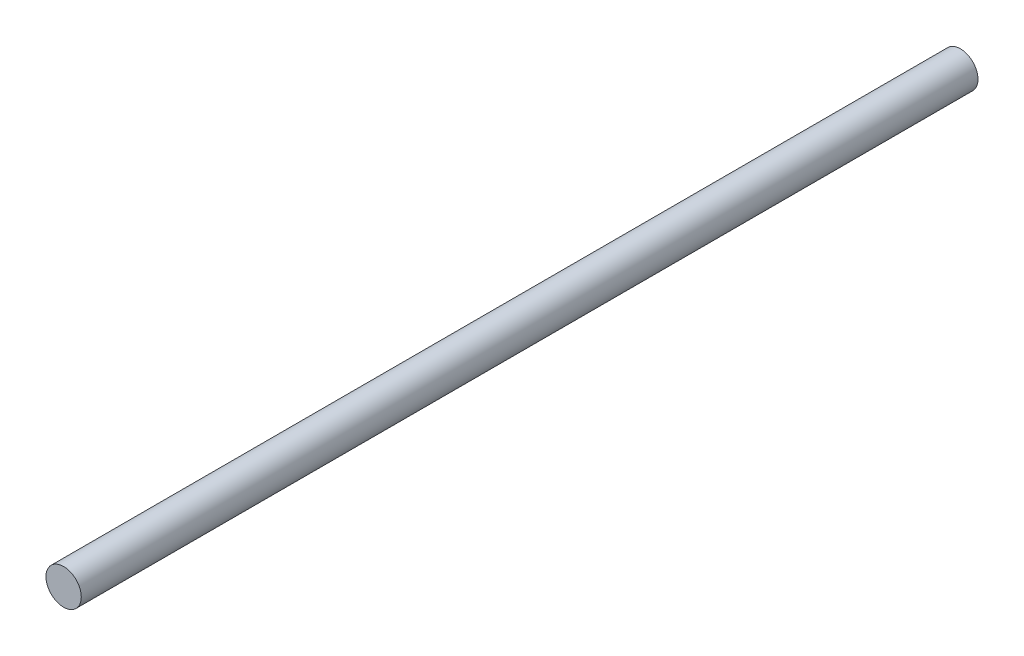
from build123d import *

# Parameters (mm, degrees)
ESQUISSE1_R      = 1.259960856
EXTRUSION1_DEPTH = 64


with BuildPart() as part:
    # Esquisse1 → Extrusion1 (new body)
    with BuildSketch(Plane.XY):
        with Locations((-4.343814251, 65.562171183)):
            Circle(ESQUISSE1_R)
    extrude(amount=-EXTRUSION1_DEPTH)


solid = part.part
